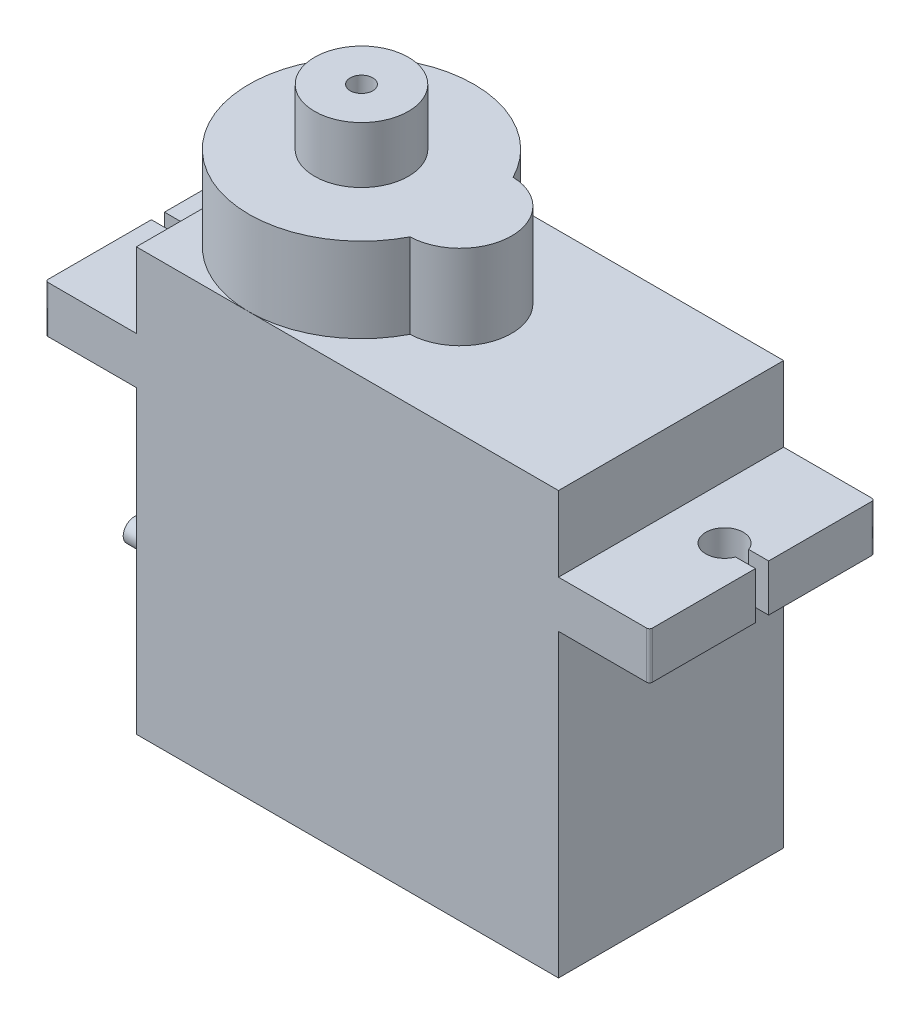
from build123d import *

# Parameters (mm, degrees)
SKETCH_2_W          = 22.5
SKETCH_2_H          = 12
EXTRUDE_1_DEPTH     = 22.5
SKETCH_3_R          = 2.75
SKETCH_3_R_2        = 6
EXTRUDE_2_DEPTH     = 4.5
SKETCH_4_R          = 2.5
EXTRUDE_3_DEPTH     = 3
SKETCH_5_R          = 0.6
CUT_EXTRUDE_1_DEPTH = 3
EXTRUDE_4_DEPTH     = 2.5
FILLET_1_R          = 0.15
EXTRUDE_5_DEPTH     = 5


with BuildPart() as part:
    # ｽｹｯﾁ2 → ﾎﾞｽ - 押し出し1 (new body)
    with BuildSketch(Plane(origin=(0, 0, 0), x_dir=(1, 0, 0), z_dir=(0, 1, 0))):
        Rectangle(SKETCH_2_W, SKETCH_2_H)
    extrude(amount=-EXTRUDE_1_DEPTH)

    # ｽｹｯﾁ3 → ﾎﾞｽ - 押し出し2 (add)
    with BuildSketch(Plane(origin=(0, 0, 0), x_dir=(1, 0, 0), z_dir=(0, 1, 0))):
        Circle(SKETCH_3_R)
        with Locations((-5.25, 0)):
            Circle(SKETCH_3_R_2)
    extrude(amount=EXTRUDE_2_DEPTH)

    # ｽｹｯﾁ4 → ﾎﾞｽ - 押し出し3 (add)
    with BuildSketch(Plane(origin=(0, 4.5, 0), x_dir=(1, 0, 0), z_dir=(0, 1, 0))):
        with Locations(Location((-5.25, 0, 0), (0, 0, 270))):
            Circle(SKETCH_4_R)
    extrude(amount=EXTRUDE_3_DEPTH)

    # ｽｹｯﾁ5 → ｶｯﾄ - 押し出し1 (cut)
    with BuildSketch(Plane(origin=(0, 7.5, 0), x_dir=(1, 0, 0), z_dir=(0, 1, 0))):
        with Locations(Location((-5.25, 0, 0), (0, 0, 270))):
            Circle(SKETCH_5_R)
    extrude(amount=-CUT_EXTRUDE_1_DEPTH, mode=Mode.SUBTRACT)

    # ｽｹｯﾁ6 → ﾎﾞｽ - 押し出し4 (add)
    with BuildSketch(Plane(origin=(0, -4, 0), x_dir=(1, 0, 0), z_dir=(0, 1, 0))):
        with BuildLine():
            Line((-16.1, -0.35), (-16.1, -6))
            Line((-16.1, -6), (16.1, -6))
            Line((16.1, -6), (16.1, -0.35))
            Line((16.1, -0.35), (15.0367497, -0.35))
            ThreePointArc((15.0367497, -0.35), (13.1, 0), (15.0367497, 0.35))
            Line((15.0367497, 0.35), (16.1, 0.35))
            Line((16.1, 0.35), (16.1, 6))
            Line((16.1, 6), (-16.1, 6))
            Line((-16.1, 6), (-16.1, 0.35))
            Line((-16.1, 0.35), (-15.0367497, 0.35))
            ThreePointArc((-15.0367497, 0.35), (-13.1, 0), (-15.0367497, -0.35))
            Line((-15.0367497, -0.35), (-16.1, -0.35))
        make_face()
    extrude(amount=-EXTRUDE_4_DEPTH)

    # ﾌｨﾚｯﾄ1
    fillet_1_edges = [part.edges().sort_by_distance(p)[0] for p in [
        (16.1, -5.25, 6),
        (-16.1, -5.25, -6),
        (16.1, -5.25, -6),
        (-16.1, -5.25, 6),
    ]]
    fillet(fillet_1_edges, radius=FILLET_1_R)

    # ｽｹｯﾁ7 → ﾎﾞｽ - 押し出し5 (add)
    with BuildSketch(Plane.ZY.offset(11.25)):
        with BuildLine():
            ThreePointArc((-0.55, -18.239791576), (0, -18.6), (0.55, -18.239791576))
            ThreePointArc((0.55, -18.239791576), (1.7, -18), (0.55, -17.760208424))
            ThreePointArc((0.55, -17.760208424), (0, -17.4), (-0.55, -17.760208424))
            ThreePointArc((-0.55, -17.760208424), (-1.7, -18), (-0.55, -18.239791576))
        make_face()
    extrude(amount=EXTRUDE_5_DEPTH)


solid = part.part
